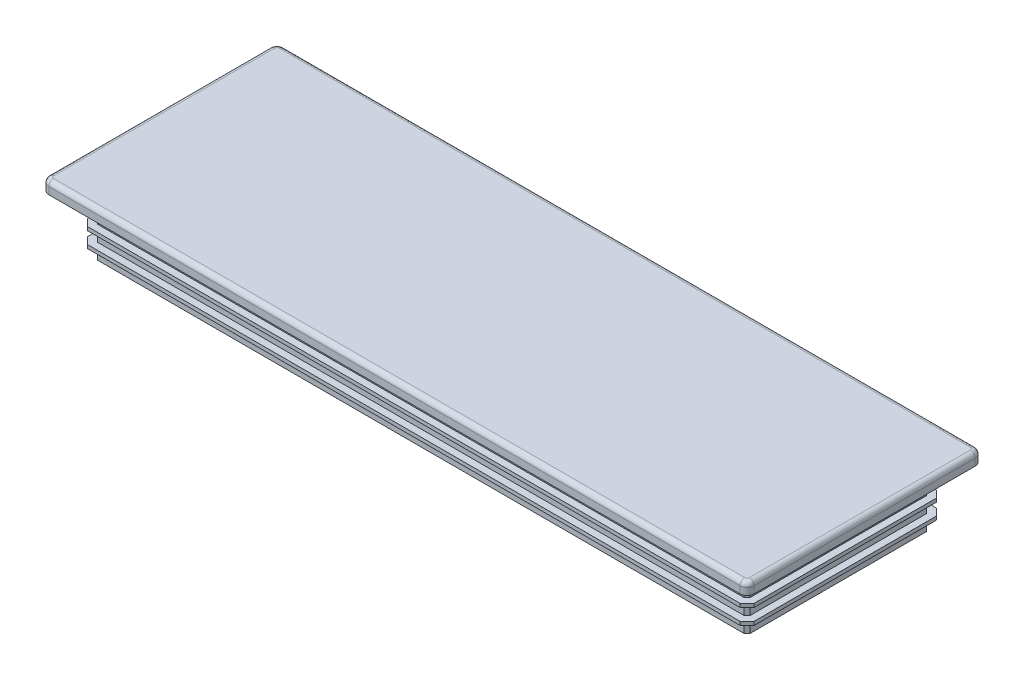
from build123d import *

# Parameters (mm, degrees)
SKETCH1_W           = 144.018
SKETCH1_H           = 42.418
BOSS_EXTRUDE1_DEPTH = 12.7
BOSS_EXTRUDE2_DEPTH = 2.54
CHAMFER1_SIZE       = 1.524
SHELL1_T            = -2.54
SKETCH4_W           = 1.524
SKETCH4_H           = 2.6035
FILLET2_R           = 1.016


with BuildPart() as part:
    # Sketch1 → Boss-Extrude1 (new body)
    with BuildSketch(Plane(origin=(0, 0, 0), x_dir=(1, 0, 0), z_dir=(0, 1, 0))):
        Rectangle(SKETCH1_W, SKETCH1_H)
    extrude(amount=BOSS_EXTRUDE1_DEPTH)

    # Sketch2 → Boss-Extrude2 (add)
    with BuildSketch(Plane(origin=(0, 12.7, 0), x_dir=(1, 0, 0), z_dir=(0, 1, 0))):
        with BuildLine():
            Line((-76.2, 23.876), (-76.2, -23.876))
            ThreePointArc((-76.2, -23.876), (-75.753630735, -24.953630735), (-74.676, -25.4))
            Line((-74.676, -25.4), (74.676, -25.4))
            ThreePointArc((74.676, -25.4), (75.753630735, -24.953630735), (76.2, -23.876))
            Line((76.2, -23.876), (76.2, 23.876))
            ThreePointArc((76.2, 23.876), (75.753630735, 24.953630735), (74.676, 25.4))
            Line((74.676, 25.4), (-74.676, 25.4))
            ThreePointArc((-74.676, 25.4), (-75.753630735, 24.953630735), (-76.2, 23.876))
        make_face()
    extrude(amount=BOSS_EXTRUDE2_DEPTH)

    # Chamfer1
    chamfer1_edges = [part.edges().sort_by_distance(p)[0] for p in [
        (72.009, 6.35, 21.209),
        (-72.009, 6.35, 21.209),
        (-72.009, 6.35, -21.209),
        (72.009, 6.35, -21.209),
    ]]
    chamfer(chamfer1_edges, length=CHAMFER1_SIZE)

    # Shell1
    shell1_openings = [part.faces().sort_by_distance(p)[0] for p in [
        (0, 0, 0),
    ]]
    offset(amount=SHELL1_T, openings=shell1_openings, kind=Kind.INTERSECTION)

    # Cut-Sweep2: sweep along a path in Sketch3
    with BuildLine(Plane(origin=(0, 0, 0), x_dir=(-1, 0, 0), z_dir=(0, -1, 0))) as cut_sweep2_path:
        Line((-72.009, 19.685), (-72.009, -19.685))
        Line((-72.009, -19.685), (-70.485, -21.209))
        Line((-70.485, -21.209), (70.485, -21.209))
        Line((70.485, -21.209), (72.009, -19.685))
        Line((72.009, -19.685), (72.009, 19.685))
        Line((72.009, 19.685), (70.485, 21.209))
        Line((70.485, 21.209), (-70.485, 21.209))
        Line((-70.485, 21.209), (-72.009, 19.685))
    # Sketch4 → Cut-Sweep2 (sweep, cut)
    with BuildSketch(Plane.XY):
        with Locations((71.247, 1.30175)):
            Rectangle(SKETCH4_W, SKETCH4_H)
        with Locations((71.247, 8.03275)):
            Rectangle(SKETCH4_W, SKETCH4_H)
        with Locations((71.247, 11.39825)):
            Rectangle(SKETCH4_W, SKETCH4_H)
        with Locations((71.247, 4.66725)):
            Rectangle(SKETCH4_W, SKETCH4_H)
    sweep(path=cut_sweep2_path.line, transition=Transition.RIGHT, mode=Mode.SUBTRACT)

    # Fillet2
    fillet2_edges = [part.edges().sort_by_distance(p)[0] for p in [
        (-75.753630735, 15.24, 24.953630735),
        (0, 15.24, 25.4),
        (75.753630735, 15.24, 24.953630735),
        (76.2, 15.24, 0),
        (75.753630735, 15.24, -24.953630735),
        (0, 15.24, -25.4),
        (-75.753630735, 15.24, -24.953630735),
        (-76.2, 15.24, 0),
    ]]
    fillet(fillet2_edges, radius=FILLET2_R)


solid = part.part
